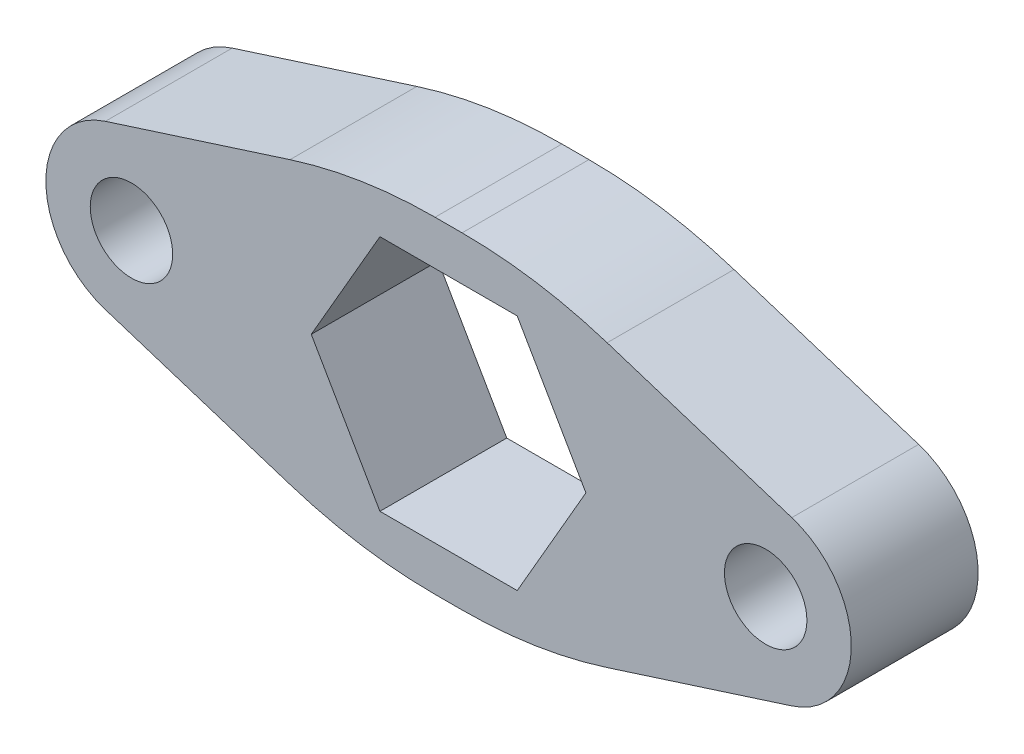
from build123d import *

# Parameters (mm, degrees)
SKETCH1_R           = 1.3
BOSS_EXTRUDE1_DEPTH = 4


with BuildPart() as part:
    # Sketch1 → Boss-Extrude1 (new body)
    with BuildSketch(Plane.XY):
        with BuildLine():
            Line((10.823243212, 2.571433572), (5, 4.435742065))
            ThreePointArc((5, 4.435742065), (2.74093184, 4.97035983), (0.426426599, 5.15))
            Line((0.426426599, 5.15), (-0.426426599, 5.15))
            ThreePointArc((-0.426426599, 5.15), (-2.74093184, 4.97035983), (-5, 4.435742065))
            Line((-5, 4.435742065), (-10.823243212, 2.571433572))
            ThreePointArc((-10.823243212, 2.571433572), (-12.7, 0), (-10.823243212, -2.571433572))
            Line((-10.823243212, -2.571433572), (-5, -4.435742065))
            ThreePointArc((-5, -4.435742065), (-2.74093184, -4.97035983), (-0.426426599, -5.15))
            Line((-0.426426599, -5.15), (0.426426599, -5.15))
            ThreePointArc((0.426426599, -5.15), (2.74093184, -4.97035983), (5, -4.435742065))
            Line((5, -4.435742065), (10.823243212, -2.571433572))
            ThreePointArc((10.823243212, -2.571433572), (12.7, 0), (10.823243212, 2.571433572))
        make_face()
        with Locations((10, 0)):
            Circle(SKETCH1_R, mode=Mode.SUBTRACT)
        with Locations(Location((-10, 0, 0), (0, 0, 180))):
            Circle(SKETCH1_R, mode=Mode.SUBTRACT)
        Polygon((2.165063509, 3.75), (-2.165063509, 3.75), (-4.330127019, 0), (-2.165063509, -3.75), (2.165063509, -3.75), (4.330127019, 0), align=None, mode=Mode.SUBTRACT)
    extrude(amount=BOSS_EXTRUDE1_DEPTH)


solid = part.part
